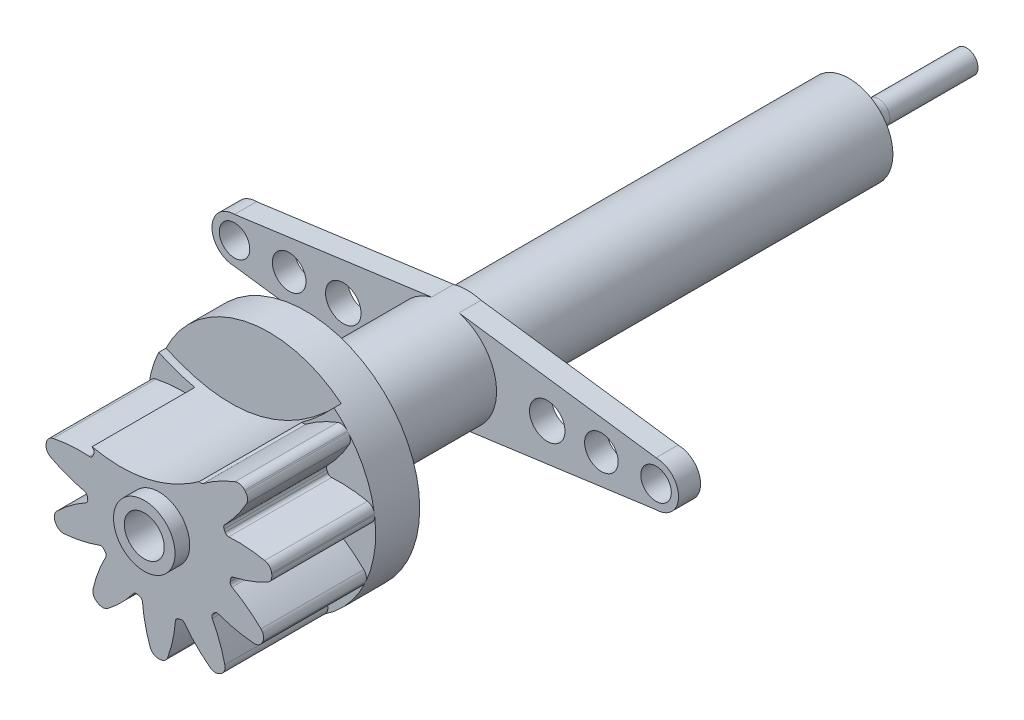
from build123d import *
from build123d.topology import SkipClean

# Parameters (mm, degrees)
ESQUISSE1_R                  = 0.596835197
BOSS_EXTRU_1_DEPTH           = 6.8
ESQUISSE2_R                  = 0.241647788
ESQUISSE2_R_2                = 0.228605582
ESQUISSE2_R_3                = 0.20802002
BOSS_EXTRU_2_DEPTH           = 0.3
BOSS_EXTRU_2_2_DEPTH         = 0.3
ESQUISSE2_3_R                = 0.596835197
BOSS_EXTRU_3_DEPTH           = 0.6
ESQUISSE3_R                  = 1.552196489
ESQUISSE3_R_2                = 0.271775186
BOSS_EXTRU_4_DEPTH           = 3.6
ENL_V_MAT_EXTRU_2_DEPTH      = 1.4
R_P_TITION_CIRCULAIRE1_COUNT = 11
ESQUISSE5_R                  = 0.418827817
ESQUISSE5_R_2                = 0.271775186
BOSS_EXTRU_5_DEPTH           = 0.2
ENL_V_MAT_EXTRU_4_DEPTH      = 1.5
ESQUISSE9_R                  = 1.552196489
ESQUISSE9_R_2                = 0.698354261
ENL_V_MAT_EXTRU_5_DEPTH      = 1.6
ESQUISSE10_R                 = 0.717525765
ESQUISSE10_R_2               = 0.156842738
ENL_V_MAT_EXTRU_6_DEPTH      = 1.6
CONG_1_R                     = 0.4


with BuildPart() as part:
    # Esquisse1 → Boss.-Extru.1 (new body)
    with BuildSketch(Plane.XY):
        Circle(ESQUISSE1_R)
    extrude(amount=BOSS_EXTRU_1_DEPTH)

    # Esquisse10 → Enlèv. mat.-Extru.6 (cut)
    with BuildSketch(Plane(origin=(0, 0, 0), x_dir=(-1, 0, 0), z_dir=(0, 0, -1))):
        Circle(ESQUISSE10_R)
        Circle(ESQUISSE10_R_2, mode=Mode.SUBTRACT)
    extrude(amount=-ENL_V_MAT_EXTRU_6_DEPTH, mode=Mode.SUBTRACT)

    # Congé1
    cong_1_edges = [part.edges().sort_by_distance(p)[0] for p in [
        (0.156842738, 0, 1.6),
    ]]
    fillet(cong_1_edges, radius=CONG_1_R)


with BuildPart() as body_2:
    # Esquisse2 → Boss.-Extru.2 (new body)
    with BuildSketch(Plane.XY.offset(6.8)):
        with BuildLine():
            ThreePointArc((2.87103353, -0.306756218), (3.177789749, 0), (2.87103353, 0.306756218))
            Line((2.87103353, 0.306756218), (0.187026302, 0.672844585))
            ThreePointArc((0.187026302, 0.672844585), (0.698354261, 0), (0.187026302, -0.672844585))
            Line((0.187026302, -0.672844585), (2.87103353, -0.306756218))
        make_face()
        with Locations((1.389047893, 0)):
            Circle(ESQUISSE2_R, mode=Mode.SUBTRACT)
        with Locations((2.126282563, 0)):
            Circle(ESQUISSE2_R_2, mode=Mode.SUBTRACT)
        with Locations((2.87103353, 0)):
            Circle(ESQUISSE2_R_3, mode=Mode.SUBTRACT)
    extrude(amount=BOSS_EXTRU_2_DEPTH)


with BuildPart() as body_3:
    # Esquisse2 → Boss.-Extru.2 2 (new body)
    with BuildSketch(Plane.XY.offset(6.8)):
        with BuildLine():
            ThreePointArc((-0.187026302, -0.672844585), (-0.698354261, 0), (-0.187026302, 0.672844585))
            Line((-0.187026302, 0.672844585), (-2.87103353, 0.306756218))
            ThreePointArc((-2.87103353, 0.306756218), (-3.177789749, 0), (-2.87103353, -0.306756218))
            Line((-2.87103353, -0.306756218), (-0.187026302, -0.672844585))
        make_face()
        with Locations((-2.87103353, 0)):
            Circle(ESQUISSE2_R_3, mode=Mode.SUBTRACT)
        with Locations((-2.126282563, 0)):
            Circle(ESQUISSE2_R_2, mode=Mode.SUBTRACT)
        with Locations((-1.389047893, 0)):
            Circle(ESQUISSE2_R, mode=Mode.SUBTRACT)
    extrude(amount=BOSS_EXTRU_2_2_DEPTH)


    add(body_2.part)  # Boss.-Extru.3 merges body 2
    # Esquisse2<3> → Boss.-Extru.3 (add)
    with BuildSketch(Plane.XY.offset(6.8)):
        with BuildLine():
            ThreePointArc((0.698354261, 0), (0.556016766, 0.422544707), (0.187026302, 0.672844585))
            ThreePointArc((0.187026302, 0.672844585), (0, 0.698354261), (-0.187026302, 0.672844585))
            ThreePointArc((-0.187026302, 0.672844585), (-0.698354261, 0), (-0.187026302, -0.672844585))
            ThreePointArc((-0.187026302, -0.672844585), (0, -0.698354261), (0.187026302, -0.672844585))
            ThreePointArc((0.187026302, -0.672844585), (0.556016766, -0.422544707), (0.698354261, 0))
        make_face()
        Circle(ESQUISSE2_3_R, mode=Mode.SUBTRACT)
    extrude(amount=BOSS_EXTRU_3_DEPTH)

    # Esquisse3 → Boss.-Extru.4 (add)
    with BuildSketch(Plane.XY.offset(7.4)):
        Circle(ESQUISSE3_R)
        Circle(ESQUISSE3_R_2, mode=Mode.SUBTRACT)
    extrude(amount=BOSS_EXTRU_4_DEPTH)

    # Esquisse4 → Enlèv. mat.-Extru.2 (cut)
    with BuildSketch(Plane.XY.offset(11)):
        with BuildLine():
            ThreePointArc((0.016541491, 0.982741953), (0, 0.982881156), (-0.016541491, 0.982741953))
            ThreePointArc((-0.016541491, 0.982741953), (-0.045376251, 0.991305699), (-0.064079894, 1.014863179))
            ThreePointArc((-0.064079894, 1.014863179), (-0.167404623, 1.238868928), (-0.299588014, 1.447152692))
            ThreePointArc((-0.299588014, 1.447152692), (-0.357615603, 1.489806577), (-0.429612026, 1.49155873))
            ThreePointArc((-0.429612026, 1.49155873), (0, 1.552196489), (0.429612026, 1.49155873))
            ThreePointArc((0.429612026, 1.49155873), (0.357615603, 1.489806577), (0.299588014, 1.447152692))
            ThreePointArc((0.299588014, 1.447152692), (0.167404623, 1.238868928), (0.064079894, 1.014863179))
            ThreePointArc((0.064079894, 1.014863179), (0.045376251, 0.991305699), (0.016541491, 0.982741953))
        make_face()
    enl_v_mat_extru_2 = extrude(amount=-ENL_V_MAT_EXTRU_2_DEPTH, mode=Mode.SUBTRACT)

    # Répétition circulaire1: Enlèv. mat.-Extru.2 ×11 about axis
    r_p_tition_circulaire1_axis = Axis((0, 0, 11), (0, 0, -1))
    for i in range(1, R_P_TITION_CIRCULAIRE1_COUNT):
        add(enl_v_mat_extru_2.rotate(r_p_tition_circulaire1_axis, i * 360 / R_P_TITION_CIRCULAIRE1_COUNT), mode=Mode.SUBTRACT)

    # Esquisse5 → Boss.-Extru.5 (add)
    with BuildSketch(Plane.XY.offset(11)):
        Circle(ESQUISSE5_R)
        Circle(ESQUISSE5_R_2, mode=Mode.SUBTRACT)
    extrude(amount=BOSS_EXTRU_5_DEPTH)

    # Esquisse8 → Enlèv. mat.-Extru.4 (cut)
    with BuildSketch(Plane.XY.offset(11)):
        with BuildLine():
            ThreePointArc((1.098813899, 1.331388128), (-0.375234691, 1.684988207), (-1.559941725, 0.739302474))
            add(Edge.make_bspline(
                [(-1.559941725, 0.739302474), (-1.194167482, 0.54544953), (-0.240876792, 0.286080462), (0.606244487, 0.75003647), (1.098813899, 1.331388128)],
                knots=[0.031577745, 0.031577745, 0.031577745, 0.031577745, 0.351065232, 0.898413475, 0.898413475, 0.898413475, 0.898413475], degree=3))
        make_face()
    extrude(amount=-ENL_V_MAT_EXTRU_4_DEPTH, mode=Mode.SUBTRACT)

    # Esquisse9 → Enlèv. mat.-Extru.5 (cut)
    with SkipClean():  # the faces are left unmerged after this step: merging them gives an invalid solid
        with BuildSketch(Plane(origin=(0, 0, 7.4), x_dir=(-1, 0, 0), z_dir=(0, 0, -1))):
            Circle(ESQUISSE9_R)
            Circle(ESQUISSE9_R_2, mode=Mode.SUBTRACT)
        extrude(amount=-ENL_V_MAT_EXTRU_5_DEPTH, mode=Mode.SUBTRACT)


solid = Compound([part.part, body_3.part])
